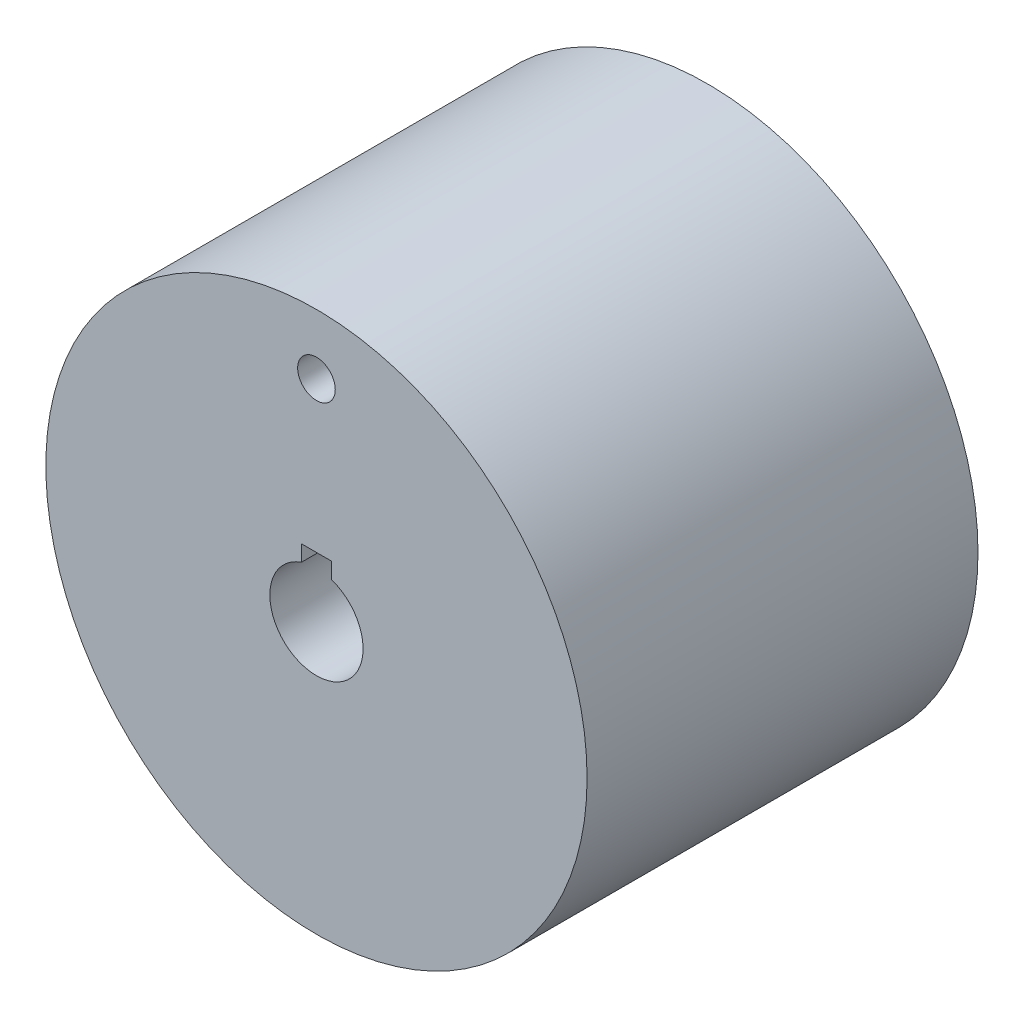
from build123d import *

# Parameters (mm, degrees)
SKETCH_1_R      = 18
SKETCH_1_R_2    = 1.25
EXTRUDE_1_DEPTH = 13


with BuildPart() as part:
    # 草图1 → 凸台-拉伸1 (new, symmetric)
    with BuildSketch(Plane.XY):
        Circle(SKETCH_1_R)
        with Locations((0, 14)):
            Circle(SKETCH_1_R_2, mode=Mode.SUBTRACT)
        with BuildLine():
            Line((-1, 2.93428015), (-1, 4))
            Line((-1, 4), (1, 4))
            Line((1, 4), (1, 2.93428015))
            ThreePointArc((1, 2.93428015), (0, -3.1), (-1, 2.93428015))
        make_face(mode=Mode.SUBTRACT)
    extrude(amount=EXTRUDE_1_DEPTH, both=True)


solid = part.part
